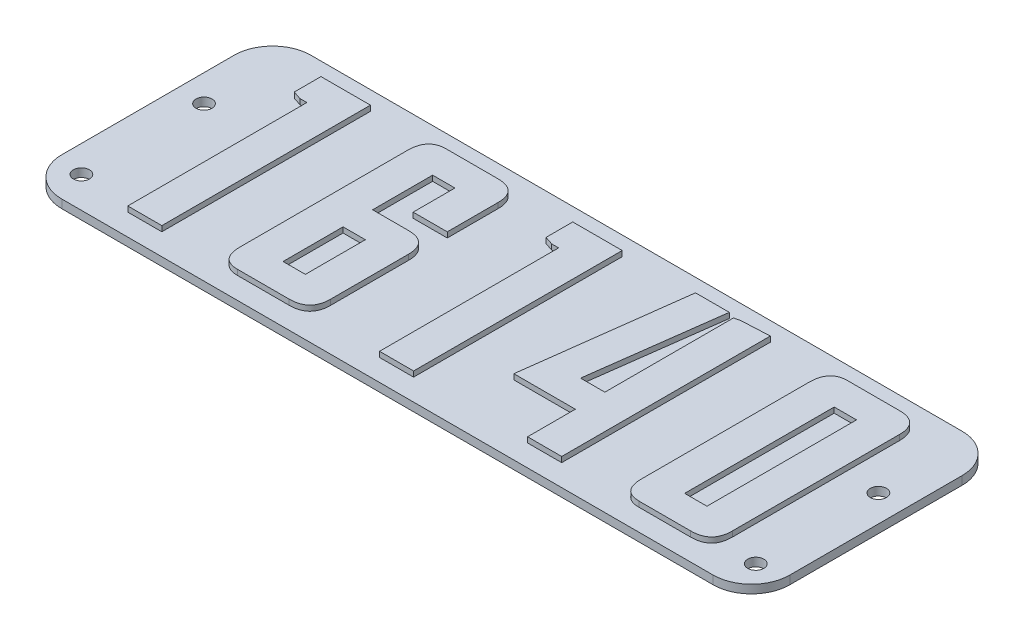
from build123d import *

# Parameters (mm, degrees)
SKETCH1_W           = 190
SKETCH1_H           = 65
SKETCH1_R           = 2.1
BOSS_EXTRUDE1_DEPTH = 2.2
SKETCH3_W           = 5.822409575
SKETCH3_H           = 15.664234042
SKETCH3_W_2         = 5.822409574
SKETCH3_H_2         = 39.034260638
BOSS_EXTRUDE3_DEPTH = 1.4
FILLET1_R           = 10


with BuildPart() as part:
    # Sketch1 → Boss-Extrude1 (new body)
    with BuildSketch(Plane(origin=(0, 0, 0), x_dir=(1, 0, 0), z_dir=(0, 1, 0))):
        Rectangle(SKETCH1_W, SKETCH1_H)
        with Locations(Location((-88, 7.623179707, 0), (0, 0, 270))):
            Circle(SKETCH1_R, mode=Mode.SUBTRACT)
        with Locations(Location((-88, -24.376820293, 0), (0, 0, 270))):
            Circle(SKETCH1_R, mode=Mode.SUBTRACT)
        with Locations(Location((88, -24.376820293, 0), (0, 0, 90))):
            Circle(SKETCH1_R, mode=Mode.SUBTRACT)
        with Locations(Location((88, 7.623179707, 0), (0, 0, 90))):
            Circle(SKETCH1_R, mode=Mode.SUBTRACT)
    extrude(amount=BOSS_EXTRUDE1_DEPTH)

    # Sketch3 → Boss-Extrude3 (add)
    # profile 1 of 5: a face of its own
    with BuildSketch(Plane(origin=(0, 2.2, 0), x_dir=(1, 0, 0), z_dir=(0, 1, 0))):
        Polygon((-77.439519604, 20.61757665), (-77.439519604, 27.58839048), (-64.531455774, 27.58839048), (-64.531455774, -26.857455265), (-73.42010471, -26.857455265), (-73.42010471, 19.882597927), (-75.234583434, 19.882597927), align=None)
    # profile 2 of 5: a face of its own
    with BuildSketch(Plane(origin=(0, 2.2, 0), x_dir=(1, 0, 0), z_dir=(0, 1, 0))):
        with BuildLine():
            Line((-34.778598327, 8.984241544), (-34.778598327, 19.882597927))
            Line((-34.778598327, 19.882597927), (-40.601007902, 19.882597927))
            Line((-40.601007902, 19.882597927), (-40.601007902, 4.218363884))
            Line((-40.601007902, 4.218363884), (-31.367837689, 4.218363884))
            add(Edge.make_bspline(
                [(-31.367837689, 4.218363884), (-30.937734177, 4.205882557), (-30.126413548, 4.182338553), (-28.991073812, 3.931040784), (-28.02102206, 3.502870767), (-27.219902727, 2.897866579), (-26.601465528, 2.109735687), (-26.1809682, 1.150054083), (-25.910893392, 0.033711404), (-25.889664372, -0.767797312), (-25.878465349, -1.190620158)],
                knots=[0, 0, 0, 0, 1.167027584, 2.201408559, 3.136967793, 4.027212192, 4.901025933, 5.82711576, 6.853730371, 8, 8, 8, 8], degree=3))
            Line((-25.878465349, -1.190620158), (-25.878465349, -21.448471222))
            add(Edge.make_bspline(
                [(-25.878465349, -21.448471222), (-25.889664372, -21.871294068), (-25.910893392, -22.672802785), (-26.1809682, -23.789145463), (-26.601465528, -24.748827067), (-27.219902727, -25.53695796), (-28.02102206, -26.141962147), (-28.991073812, -26.570132165), (-30.126413548, -26.821429933), (-30.937734177, -26.844973937), (-31.367837689, -26.857455265)],
                knots=[0, 0, 0, 0, 1.146269629, 2.17288424, 3.098974067, 3.972787808, 4.863032207, 5.798591441, 6.832972416, 8, 8, 8, 8], degree=3))
            Line((-31.367837689, -26.857455265), (-44.746747264, -26.857455265))
            add(Edge.make_bspline(
                [(-44.746747264, -26.857455265), (-45.119703537, -26.844982711), (-45.825659581, -26.821373845), (-46.813372336, -26.566574969), (-47.656481489, -26.137409968), (-48.33959709, -25.520537859), (-48.870362201, -24.736796043), (-49.228799232, -23.781135063), (-49.463163603, -22.669394461), (-49.48049008, -21.870915209), (-49.489656838, -21.448471222)],
                knots=[0, 0, 0, 0, 1.084734094, 2.05325569, 2.94625814, 3.815111374, 4.706091482, 5.677498929, 6.771255973, 8, 8, 8, 8], degree=3))
            Line((-49.489656838, -21.448471222), (-49.489656838, 22.179406438))
            add(Edge.make_bspline(
                [(-49.489656838, 22.179406438), (-49.48049008, 22.601850424), (-49.463163603, 23.400329677), (-49.228799232, 24.512070279), (-48.870362201, 25.467731259), (-48.33959709, 26.251473075), (-47.656481489, 26.868345184), (-46.813372336, 27.297510184), (-45.825659581, 27.55230906), (-45.119703537, 27.575917926), (-44.746747264, 27.58839048)],
                knots=[0, 0, 0, 0, 1.228744027, 2.322501071, 3.293908518, 4.184888626, 5.05374186, 5.94674431, 6.915265906, 8, 8, 8, 8], degree=3))
            Line((-44.746747264, 27.58839048), (-31.367837689, 27.58839048))
            add(Edge.make_bspline(
                [(-31.367837689, 27.58839048), (-30.937734177, 27.575909152), (-30.126413548, 27.552365149), (-28.991073812, 27.30106738), (-28.02102206, 26.872897363), (-27.219902727, 26.267893175), (-26.601465528, 25.479762283), (-26.1809682, 24.520080679), (-25.910893392, 23.403738), (-25.889664372, 22.602229284), (-25.878465349, 22.179406438)],
                knots=[0, 0, 0, 0, 1.167027584, 2.201408559, 3.136967793, 4.027212192, 4.901025933, 5.82711576, 6.853730371, 8, 8, 8, 8], degree=3))
            Line((-25.878465349, 22.179406438), (-25.878465349, 8.984241544))
            Line((-25.878465349, 8.984241544), (-34.778598327, 8.984241544))
        make_face()
        with Locations((-37.689803115, -11.31954569)):
            Rectangle(SKETCH3_W, SKETCH3_H, mode=Mode.SUBTRACT)
    # profile 3 of 5: a face of its own
    with BuildSketch(Plane(origin=(0, 2.2, 0), x_dir=(1, 0, 0), z_dir=(0, 1, 0))):
        Polygon((-11.732421732, 20.61757665), (-11.732421732, 27.58839048), (1.175642098, 27.58839048), (1.175642098, -26.857455265), (-7.713006838, -26.857455265), (-7.713006838, 19.882597927), (-9.527485561, 19.882597927), align=None)
    # profile 4 of 5: a face of its own
    with BuildSketch(Plane(origin=(0, 2.2, 0), x_dir=(1, 0, 0), z_dir=(0, 1, 0))):
        Polygon((32.398456992, 27.220901118), (39.828632524, 27.58839048), (39.828632524, -26.857455265), (30.928499545, -26.857455265), (30.928499545, -14.397269094), (14.873808056, -14.397269094), (20.305760183, 27.58839048), (29.125504864, 27.58839048), (24.577824013, -6.691476541), (30.928499545, -6.691476541), (30.928499545, 26.853411757), align=None)
    # profile 5 of 5: a face of its own
    with BuildSketch(Plane(origin=(0, 2.2, 0), x_dir=(1, 0, 0), z_dir=(0, 1, 0))):
        with BuildLine():
            add(Edge.make_bspline(
                [(73.440128268, 27.58839048), (73.870231781, 27.575909152), (74.68155241, 27.552365149), (75.816892146, 27.30106738), (76.786943898, 26.872897363), (77.58806323, 26.267893175), (78.20650043, 25.479762283), (78.626997757, 24.520080679), (78.897072565, 23.403738), (78.918301585, 22.602229284), (78.929500609, 22.179406438)],
                knots=[0, 0, 0, 0, 1.167027584, 2.201408559, 3.136967793, 4.027212192, 4.901025933, 5.82711576, 6.853730371, 8, 8, 8, 8], degree=3))
            Line((78.929500609, 22.179406438), (78.929500609, -21.448471222))
            add(Edge.make_bspline(
                [(78.929500609, -21.448471222), (78.918301585, -21.871294068), (78.897072565, -22.672802785), (78.626997757, -23.789145463), (78.20650043, -24.748827067), (77.58806323, -25.53695796), (76.786943898, -26.141962147), (75.816892146, -26.570132165), (74.68155241, -26.821429933), (73.870231781, -26.844973937), (73.440128268, -26.857455265)],
                knots=[0, 0, 0, 0, 1.146269629, 2.17288424, 3.098974067, 3.972787808, 4.863032207, 5.798591441, 6.832972416, 8, 8, 8, 8], degree=3))
            Line((73.440128268, -26.857455265), (60.061218694, -26.857455265))
            add(Edge.make_bspline(
                [(60.061218694, -26.857455265), (59.688262421, -26.844982711), (58.982306376, -26.821373845), (57.994593622, -26.566574969), (57.151484468, -26.137409968), (56.468368867, -25.520537859), (55.937603756, -24.736796043), (55.579166725, -23.781135063), (55.344802355, -22.669394461), (55.327475878, -21.870915209), (55.318309119, -21.448471222)],
                knots=[0, 0, 0, 0, 1.084734094, 2.05325569, 2.94625814, 3.815111374, 4.706091482, 5.677498929, 6.771255973, 8, 8, 8, 8], degree=3))
            Line((55.318309119, -21.448471222), (55.318309119, 22.179406438))
            add(Edge.make_bspline(
                [(55.318309119, 22.179406438), (55.327475878, 22.601850424), (55.344802355, 23.400329677), (55.579166725, 24.512070279), (55.937603756, 25.467731259), (56.468368867, 26.251473075), (57.151484468, 26.868345184), (57.994593622, 27.297510184), (58.982306376, 27.55230906), (59.688262421, 27.575917926), (60.061218694, 27.58839048)],
                knots=[0, 0, 0, 0, 1.228744027, 2.322501071, 3.293908518, 4.184888626, 5.05374186, 5.94674431, 6.915265906, 8, 8, 8, 8], degree=3))
            Line((60.061218694, 27.58839048), (73.440128268, 27.58839048))
        make_face()
        with Locations((67.118162843, 0.365467608)):
            Rectangle(SKETCH3_W_2, SKETCH3_H_2, mode=Mode.SUBTRACT)
    extrude(amount=BOSS_EXTRUDE3_DEPTH)

    # Fillet1
    fillet1_edges = [part.edges().sort_by_distance(p)[0] for p in [
        (95, 1.1, 32.5),
        (-95, 1.1, 32.5),
        (-95, 1.1, -32.5),
        (95, 1.1, -32.5),
    ]]
    fillet(fillet1_edges, radius=FILLET1_R)


solid = part.part
